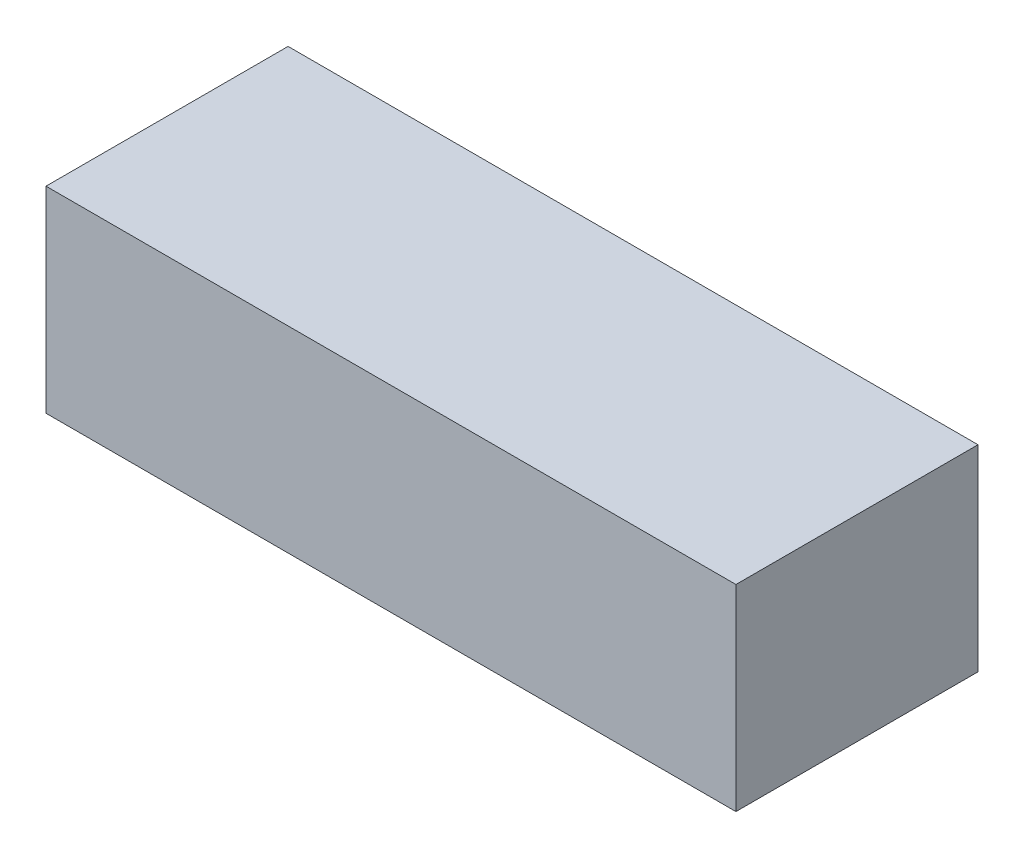
from build123d import *

# Parameters (mm, degrees)
SKETCH1_W           = 228
SKETCH1_H           = 80
BOSS_EXTRUDE1_DEPTH = 65


with BuildPart() as part:
    # Sketch1 → Boss-Extrude1 (new body)
    with BuildSketch(Plane(origin=(0, 0, 0), x_dir=(1, 0, 0), z_dir=(0, 1, 0))):
        with Locations((114, 40)):
            Rectangle(SKETCH1_W, SKETCH1_H)
    extrude(amount=BOSS_EXTRUDE1_DEPTH)


solid = part.part
